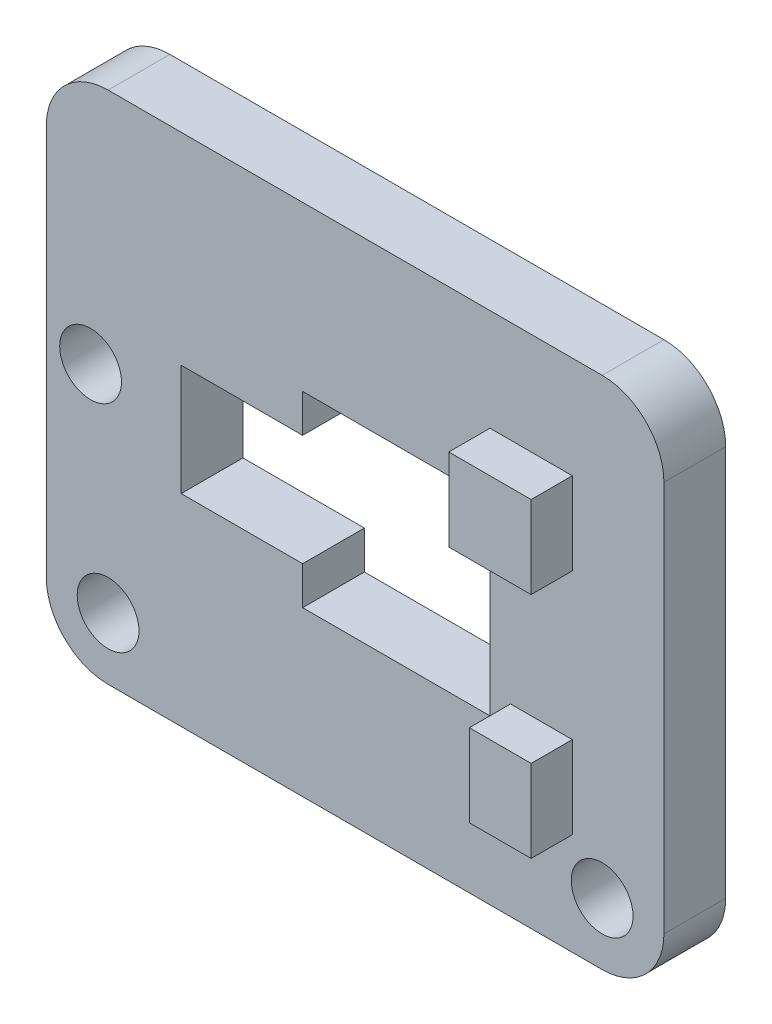
from build123d import *

# Parameters (mm, degrees)
SKETCH_1_W          = 30
SKETCH_1_H          = 25
EXTRUDE_1_DEPTH     = 3
CUT_EXTRUDE_1_DEPTH = 20.754746265
SKETCH_3_W          = 4
SKETCH_3_H          = 4
SKETCH_3_W_2        = 3
EXTRUDE_2_DEPTH     = 2
FILLET_1_R          = 3
SKETCH_4_R          = 1.5
CUT_EXTRUDE_2_DEPTH = 21.155644371
SKETCH_5_R          = 1.5
CUT_EXTRUDE_3_DEPTH = 8


with BuildPart() as part:
    # 草图1 → 凸台-拉伸1 (new body)
    with BuildSketch(Plane.XY):
        Rectangle(SKETCH_1_W, SKETCH_1_H)
    extrude(amount=EXTRUDE_1_DEPTH)

    # 草图2 → 切除-拉伸1 (cut, through all)
    with BuildSketch(Plane.XY.offset(3)):
        Polygon((6.55, 0), (6.55, 4.55), (-2.55, 4.55), (-2.55, 2.7), (-8.45, 2.7), (-8.45, 0), (-8.45, -2.7), (-2.55, -2.7), (-2.55, -4.55), (6.55, -4.55), align=None)
    extrude(amount=-CUT_EXTRUDE_1_DEPTH, mode=Mode.SUBTRACT)

    # 草图3 → 凸台-拉伸2 (add)
    with BuildSketch(Plane.XY.offset(3)):
        with Locations((8.55, 5.55)):
            Rectangle(SKETCH_3_W, SKETCH_3_H)
        with Locations((9.05, -5.55)):
            Rectangle(SKETCH_3_W_2, SKETCH_3_H)
    extrude(amount=EXTRUDE_2_DEPTH)

    # 圆角1
    fillet_1_edges = [part.edges().sort_by_distance(p)[0] for p in [
        (-15, 12.5, 1.5),
        (15, 12.5, 1.5),
        (15, -12.5, 1.5),
        (-15, -12.5, 1.5),
    ]]
    fillet(fillet_1_edges, radius=FILLET_1_R)

    # 草图4 → 切除-拉伸2 (cut, through all)
    with BuildSketch(Plane(origin=(0, 0, 0), x_dir=(-1, 0, 0), z_dir=(0, 0, -1))):
        with Locations((12, -9.5)):
            Circle(SKETCH_4_R)
        with Locations((-12, -9.5)):
            Circle(SKETCH_4_R)
    extrude(amount=-CUT_EXTRUDE_2_DEPTH, mode=Mode.SUBTRACT)

    # 草图5 → 切除-拉伸3 (cut)
    with BuildSketch(Plane(origin=(0, 0, 0), x_dir=(-1, 0, 0), z_dir=(0, 0, -1))):
        with Locations((12.85, 0.55)):
            Circle(SKETCH_5_R)
    extrude(amount=-CUT_EXTRUDE_3_DEPTH, mode=Mode.SUBTRACT)


solid = part.part
